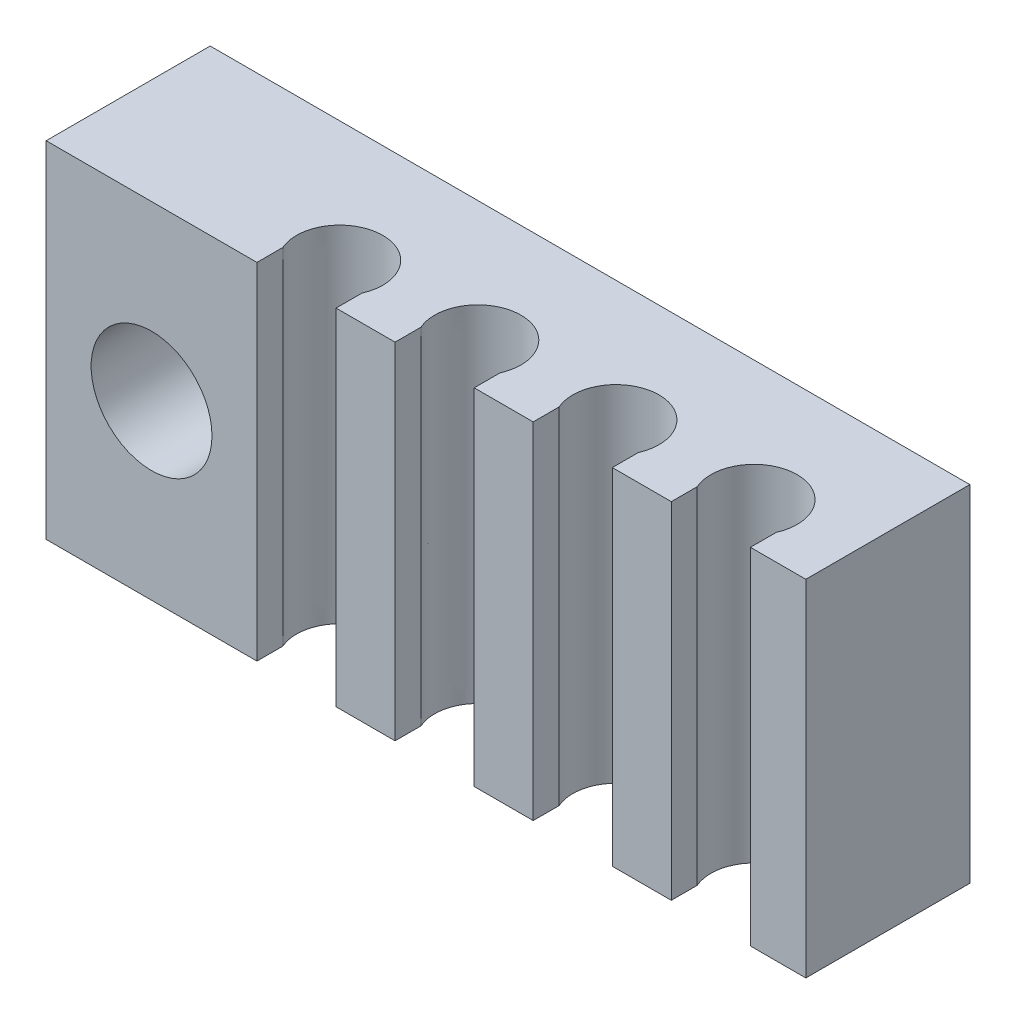
from build123d import *

# Parameters (mm, degrees)
BOSS_EXTRUDE1_DEPTH = 10
SKETCH4_R           = 1.75
CUT_EXTRUDE2_DEPTH  = 21.287003229


with BuildPart() as part:
    # Sketch1 → Boss-Extrude1 (new body)
    with BuildSketch(Plane(origin=(0, 0, 0), x_dir=(1, 0, 0), z_dir=(0, 1, 0))):
        with BuildLine():
            Line((17, 4), (-5, 4))
            Line((-5, 4), (-5, -0.75))
            Line((-5, -0.75), (1.104356076, -0.75))
            Line((1.104356076, -0.75), (1.104356076, 0))
            ThreePointArc((1.104356076, 0), (2.25, 1.75), (3.395643924, 0))
            Line((3.395643924, 0), (3.395643924, -0.75))
            Line((3.395643924, -0.75), (5.104356076, -0.75))
            Line((5.104356076, -0.75), (5.104356076, 0))
            ThreePointArc((5.104356076, 0), (6.25, 1.75), (7.395643924, 0))
            Line((7.395643924, 0), (7.395643924, -0.75))
            Line((7.395643924, -0.75), (9.104356076, -0.75))
            Line((9.104356076, -0.75), (9.104356076, 0))
            ThreePointArc((9.104356076, 0), (10.25, 1.75), (11.395643924, 0))
            Line((11.395643924, 0), (11.395643924, -0.75))
            Line((11.395643924, -0.75), (13.104356076, -0.75))
            Line((13.104356076, -0.75), (13.104356076, 0))
            ThreePointArc((13.104356076, 0), (14.25, 1.75), (15.395643924, 0))
            Line((15.395643924, 0), (15.395643924, -0.75))
            Line((15.395643924, -0.75), (17, -0.75))
            Line((17, -0.75), (17, 4))
        make_face()
    extrude(amount=BOSS_EXTRUDE1_DEPTH)

    # Sketch4 → Cut-Extrude2 (cut, through all)
    with BuildSketch(Plane.XY.offset(0.75)):
        with Locations((-1.947821962, 5)):
            Circle(SKETCH4_R)
    extrude(amount=-CUT_EXTRUDE2_DEPTH, mode=Mode.SUBTRACT)


solid = part.part
